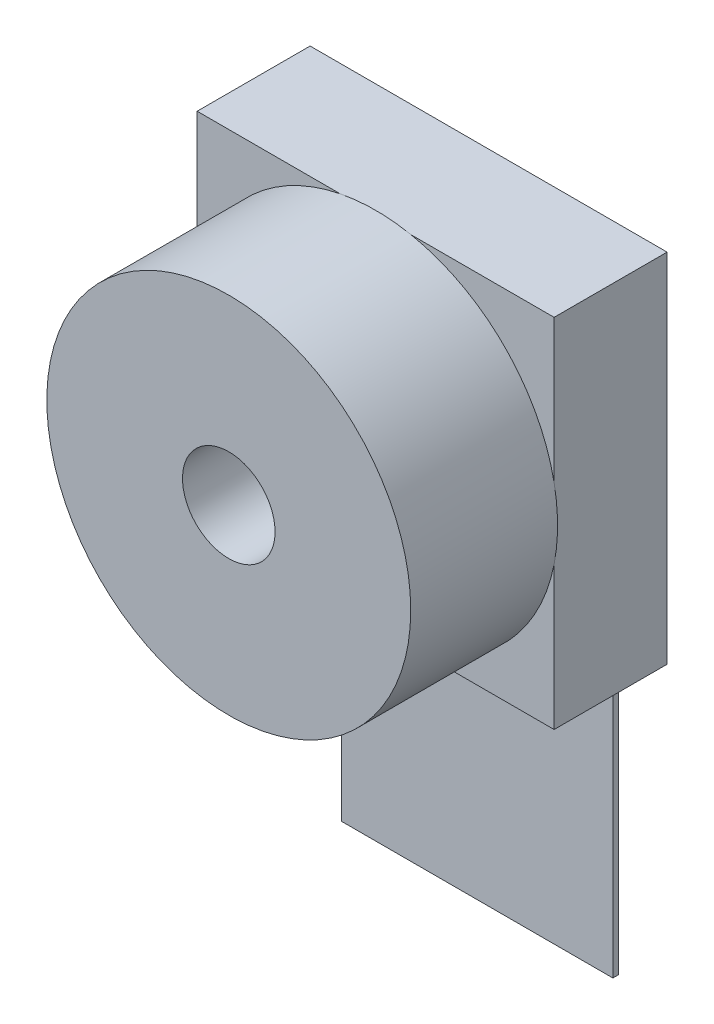
from build123d import *

# Parameters (mm, degrees)
SKETCH1_W           = 8.0264
SKETCH1_H           = 8.0264
BOSS_EXTRUDE1_DEPTH = 2.286
SKETCH2_R           = 4.091254354
BOSS_EXTRUDE2_DEPTH = 3.302
SKETCH3_R           = 1.040494651
CUT_EXTRUDE1_DEPTH  = 3.302
SKETCH8_W           = 6.096
SKETCH8_H           = 13.5255
BOSS_EXTRUDE6_DEPTH = 0.127
SKETCH9_W           = 8.0264
SKETCH9_H           = 8.0264
BOSS_EXTRUDE7_DEPTH = 0.254


with BuildPart() as part:
    # Sketch1 → Boss-Extrude1 (new body)
    with BuildSketch(Plane.XY):
        Rectangle(SKETCH1_W, SKETCH1_H)
    extrude(amount=BOSS_EXTRUDE1_DEPTH)

    # Sketch2 → Boss-Extrude2 (add)
    with BuildSketch(Plane.XY.offset(2.286)):
        with Locations(Location((0, 0, 0), (0, 0, 168.79012288))):
            Circle(SKETCH2_R)
    extrude(amount=BOSS_EXTRUDE2_DEPTH)

    # Sketch3 → Cut-Extrude1 (cut)
    with BuildSketch(Plane.XY.offset(5.588)):
        Circle(SKETCH3_R)
    extrude(amount=-CUT_EXTRUDE1_DEPTH, mode=Mode.SUBTRACT)

    # Sketch8 → Boss-Extrude6 (add)
    with BuildSketch(Plane(origin=(0, 0, 0), x_dir=(-1, 0, 0), z_dir=(0, 0, -1))):
        with Locations((0, -3.71475)):
            Rectangle(SKETCH8_W, SKETCH8_H)
    extrude(amount=BOSS_EXTRUDE6_DEPTH)

    # Sketch9 → Boss-Extrude7 (add)
    with BuildSketch(Plane(origin=(0, 0, 0), x_dir=(-1, 0, 0), z_dir=(0, 0, -1))):
        Rectangle(SKETCH9_W, SKETCH9_H)
    extrude(amount=BOSS_EXTRUDE7_DEPTH)


solid = part.part
